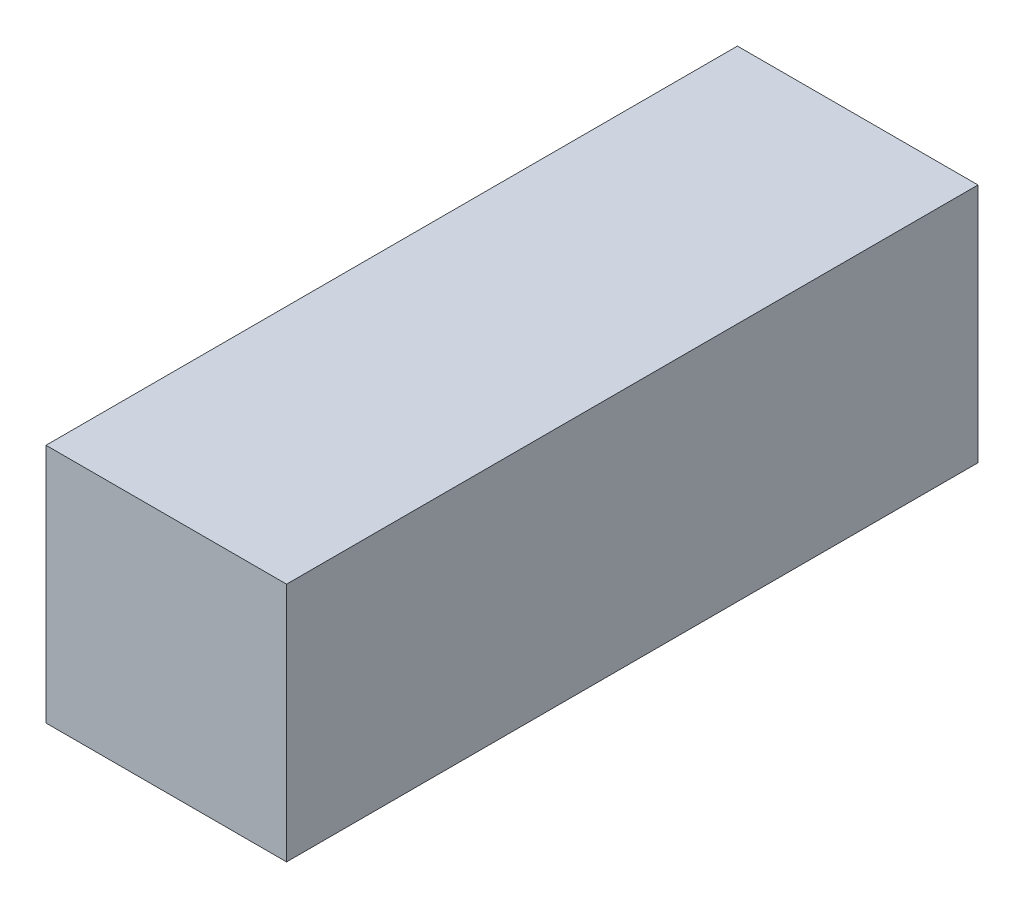
from build123d import *

# Parameters (mm, degrees)
SKETCH1_W           = 6.35
SKETCH1_H           = 6.35
BOSS_EXTRUDE1_DEPTH = 18.25


with BuildPart() as part:
    # Sketch1 → Boss-Extrude1 (new body)
    with BuildSketch(Plane.XY):
        Rectangle(SKETCH1_W, SKETCH1_H)
    extrude(amount=BOSS_EXTRUDE1_DEPTH)


solid = part.part
